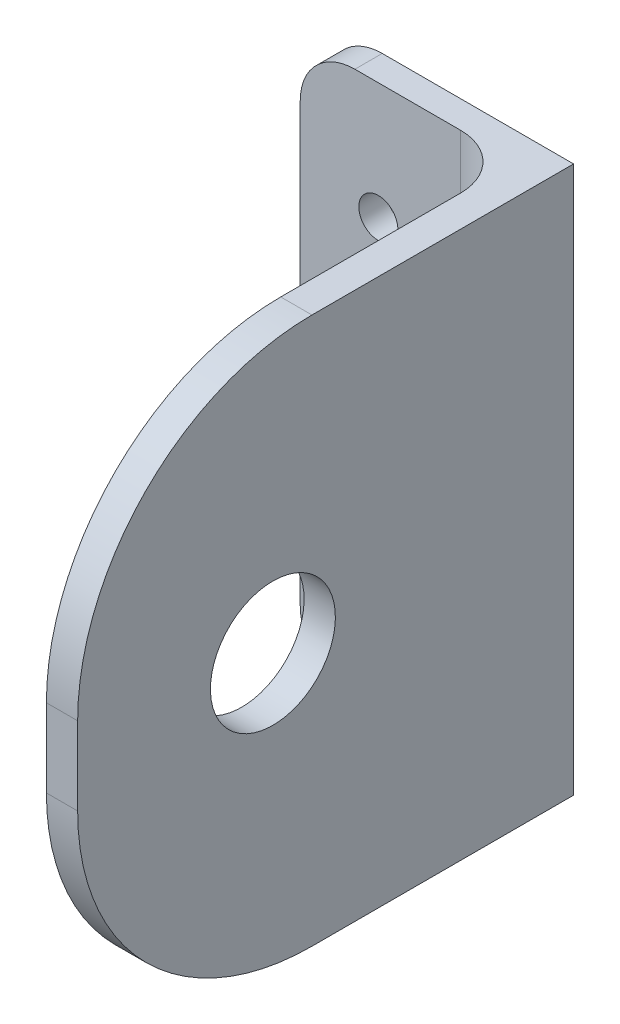
from build123d import *

# Parameters (mm, degrees)
BOSS_EXTRU_1_DEPTH      = 3.5
ESQUISSE2_R             = 2.5
ENL_V_MAT_EXTRU_1_DEPTH = 3.5
ESQUISSE3_W             = 4
ESQUISSE3_H             = 70
BOSS_EXTRU_2_DEPTH      = 60
ESQUISSE4_R             = 8
ENL_V_MAT_EXTRU_2_DEPTH = 6
CONG_1_R                = 30
ESQUISSE5_W             = 3.5
ESQUISSE5_H             = 70
BOSS_EXTRU_4_DEPTH      = 11.5
CONG_3_R                = 7


with BuildPart() as part:
    # Esquisse1 → Boss.-Extru.1 (new body)
    with BuildSketch(Plane.XY):
        with BuildLine():
            Line((9.27027027, 7.756756757), (16.27027027, 7.756756757))
            Line((16.27027027, 7.756756757), (16.27027027, 0.756756757))
            Line((16.27027027, 0.756756757), (16.27027027, -55.243243243))
            Line((16.27027027, -55.243243243), (16.27027027, -62.243243243))
            Line((16.27027027, -62.243243243), (9.27027027, -62.243243243))
            Line((9.27027027, -62.243243243), (3.27027027, -62.243243243))
            ThreePointArc((3.27027027, -62.243243243), (-1.679477198, -60.192990712), (-3.72972973, -55.243243243))
            Line((-3.72972973, -55.243243243), (-3.72972973, 0.756756757))
            ThreePointArc((-3.72972973, 0.756756757), (-1.679477198, 5.706504225), (3.27027027, 7.756756757))
            Line((3.27027027, 7.756756757), (9.27027027, 7.756756757))
        make_face()
    extrude(amount=BOSS_EXTRU_1_DEPTH)

    # Esquisse2 → Enlèv. mat.-Extru.1 (cut)
    with BuildSketch(Plane.XY.offset(3.5)):
        with Locations((6.27027027, -7.243243243)):
            Circle(ESQUISSE2_R)
        with Locations((6.27027027, -47.243243243)):
            Circle(ESQUISSE2_R)
    extrude(amount=-ENL_V_MAT_EXTRU_1_DEPTH, mode=Mode.SUBTRACT)



with BuildPart() as body_2:
    # Esquisse3 → Boss.-Extru.2 (new body)
    with BuildSketch(Plane.XY.offset(3.5)):
        with Locations((25.77027027, -27.243243243)):
            Rectangle(ESQUISSE3_W, ESQUISSE3_H)
    extrude(amount=BOSS_EXTRU_2_DEPTH)

    # Esquisse4 → Enlèv. mat.-Extru.2 (cut)
    with BuildSketch(Plane(origin=(27.77027027, 0, 0), x_dir=(0, 0, -1), z_dir=(1, 0, 0))):
        with Locations(Location((-38.5, -27.243243243, 0), (0, 0, 90))):
            Circle(ESQUISSE4_R)
    extrude(amount=-ENL_V_MAT_EXTRU_2_DEPTH, mode=Mode.SUBTRACT)

    # Congé1
    cong_1_edges = [body_2.edges().sort_by_distance(p)[0] for p in [
        (25.77027027, 7.756756757, 63.5),
        (25.77027027, -62.243243243, 63.5),
    ]]
    fillet(cong_1_edges, radius=CONG_1_R)


with BuildPart() as part_1:
    add(part.part)

    add(body_2.part)  # Boss.-Extru.4 merges body 2
    # Esquisse5 → Boss.-Extru.4 (add)
    with BuildSketch(Plane(origin=(16.27027027, 0, 0), x_dir=(0, 0, -1), z_dir=(1, 0, 0))):
        with Locations((-1.75, -27.243243243)):
            Rectangle(ESQUISSE5_W, ESQUISSE5_H)
    extrude(amount=BOSS_EXTRU_4_DEPTH)

    # Congé3
    cong_3_edges = [part_1.edges().sort_by_distance(p)[0] for p in [
        (23.77027027, -27.243243243, 3.5),
    ]]
    fillet(cong_3_edges, radius=CONG_3_R)


solid = part_1.part
